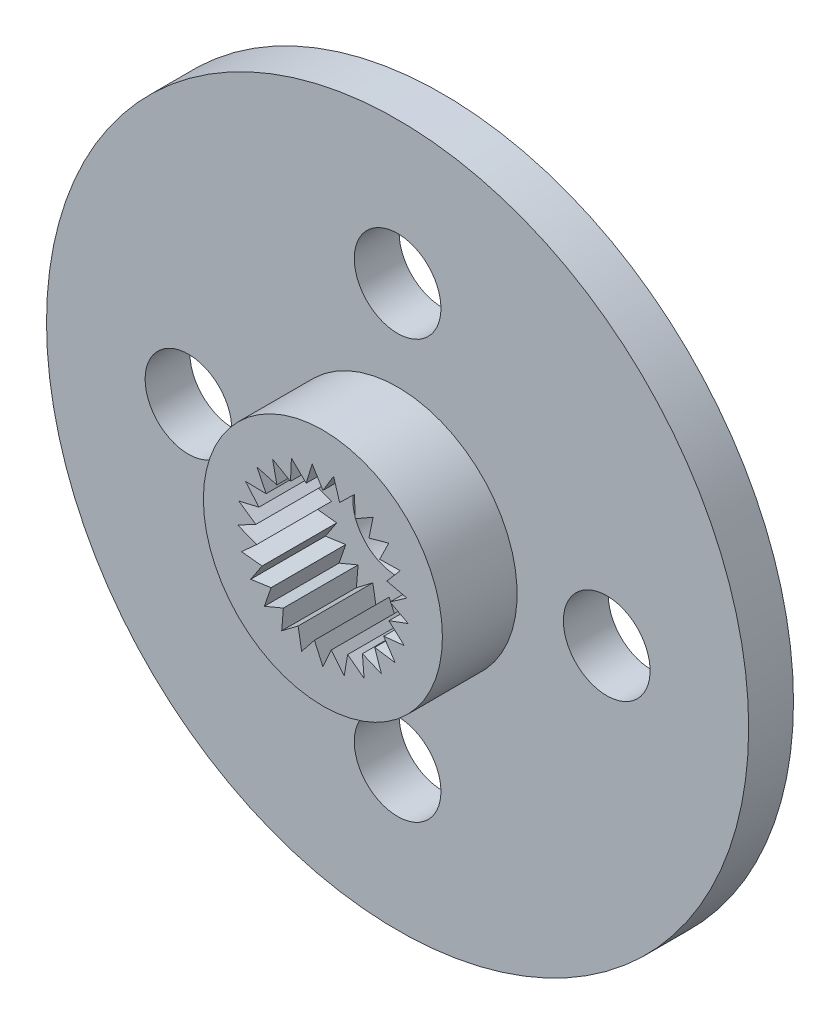
from build123d import *

# Parameters (mm, degrees)
SKETCH_1_R      = 4
EXTRUDE_1_DEPTH = 2.5
SKETCH_2_R      = 11.75
SKETCH_2_R_2    = 1.45
SKETCH_2_R_3    = 1.5
EXTRUDE_2_DEPTH = 1.5


with BuildPart() as part:
    # 草图1 → 凸台-拉伸1 (new body)
    with BuildSketch(Plane.XY):
        Circle(SKETCH_1_R)
        Polygon((0, 2.25), (0.358703838, 2.839433251), (0.559552246, 2.179312113), (1.053572832, 2.661021217), (1.083945767, 1.97169003), (1.68224197, 2.315407433), (1.540230988, 1.640179412), (2.205209658, 1.824308085), (1.899737832, 1.205610289), (2.589615914, 1.218580751), (2.139877162, 0.695288237), (2.811307077, 0.536285507), (2.245560139, 0.141278669), (2.856353478, -0.179706529), (2.210146314, -0.421607958), (2.721924685, -0.884406942), (2.035860868, -0.958003406), (2.416467353, -1.533536814), (1.733654796, -1.434203977), (1.95917449, -2.086308928), (1.322516818, -1.820288237), (1.378779489, -2.50799058), (0.828280244, -2.091997093), (0.711750702, -2.772085959), (0.281999776, -2.232258078), (0, -2.862000983), (-0.281999776, -2.232258078), (-0.711750702, -2.772085959), (-0.828280244, -2.091997093), (-1.378779489, -2.50799058), (-1.322516818, -1.820288237), (-1.95917449, -2.086308928), (-1.733654796, -1.434203977), (-2.416467353, -1.533536814), (-2.035860868, -0.958003406), (-2.721924685, -0.884406942), (-2.210146314, -0.421607958), (-2.856353478, -0.179706529), (-2.245560139, 0.141278669), (-2.811307077, 0.536285507), (-2.139877162, 0.695288237), (-2.589615914, 1.218580751), (-1.899737832, 1.205610289), (-2.205209658, 1.824308085), (-1.540230988, 1.640179412), (-1.68224197, 2.315407433), (-1.083945767, 1.97169003), (-1.053572832, 2.661021217), (-0.559552246, 2.179312113), (-0.358703838, 2.839433251), align=None, mode=Mode.SUBTRACT)
    extrude(amount=EXTRUDE_1_DEPTH)

    # 草图2 → 凸台-拉伸2 (add)
    with BuildSketch(Plane(origin=(0, 0, 0), x_dir=(-1, 0, 0), z_dir=(0, 0, -1))):
        Circle(SKETCH_2_R)
        with Locations((-7, 0)):
            Circle(SKETCH_2_R_2, mode=Mode.SUBTRACT)
        with Locations((0, 7)):
            Circle(SKETCH_2_R_2, mode=Mode.SUBTRACT)
        with Locations((7, 0)):
            Circle(SKETCH_2_R_2, mode=Mode.SUBTRACT)
        with Locations((0, -7)):
            Circle(SKETCH_2_R_2, mode=Mode.SUBTRACT)
        Circle(SKETCH_2_R_3, mode=Mode.SUBTRACT)
    extrude(amount=EXTRUDE_2_DEPTH)


solid = part.part
